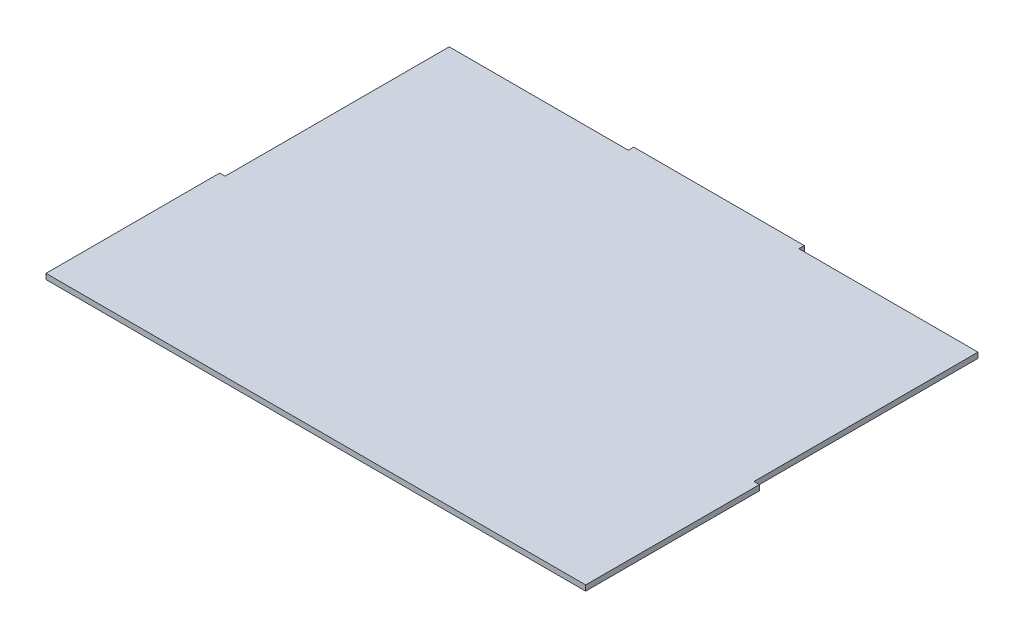
from build123d import *

# Parameters (mm, degrees)
SKETCH1_W           = 315.58
SKETCH1_H           = 3.175
BOSS_EXTRUDE1_DEPTH = 232.600000128
SKETCH5_W           = 3.175
SKETCH5_H           = 130.999992
CUT_EXTRUDE2_DEPTH  = 282.088108579
SKETCH8_W           = 99.68
SKETCH8_H           = 3.175
BOSS_EXTRUDE2_DEPTH = 3.175


with BuildPart() as part:
    # Sketch1 → Boss-Extrude1 (new body)
    with BuildSketch(Plane.XY):
        Rectangle(SKETCH1_W, SKETCH1_H)
    extrude(amount=BOSS_EXTRUDE1_DEPTH)

    # Sketch5 → Cut-Extrude2 (cut, symmetric)
    with BuildSketch(Plane(origin=(0, 1.5875, 0), x_dir=(1, 0, 0), z_dir=(0, 1, 0))):
        with Locations((-156.2025, -65.499996)):
            Rectangle(SKETCH5_W, SKETCH5_H)
    cut_extrude2 = extrude(amount=CUT_EXTRUDE2_DEPTH, both=True, mode=Mode.SUBTRACT)

    # Mirror1: Cut-Extrude2 across plane
    add(cut_extrude2.mirror(Plane(origin=(0, 0, 0), x_dir=(0, 0, 1), z_dir=(1, 0, 0))), mode=Mode.SUBTRACT)

    # Sketch8 → Boss-Extrude2 (add)
    with BuildSketch(Plane(origin=(0, 0, 0), x_dir=(-1, 0, 0), z_dir=(0, 0, -1))):
        Rectangle(SKETCH8_W, SKETCH8_H)
    extrude(amount=BOSS_EXTRUDE2_DEPTH)


solid = part.part
